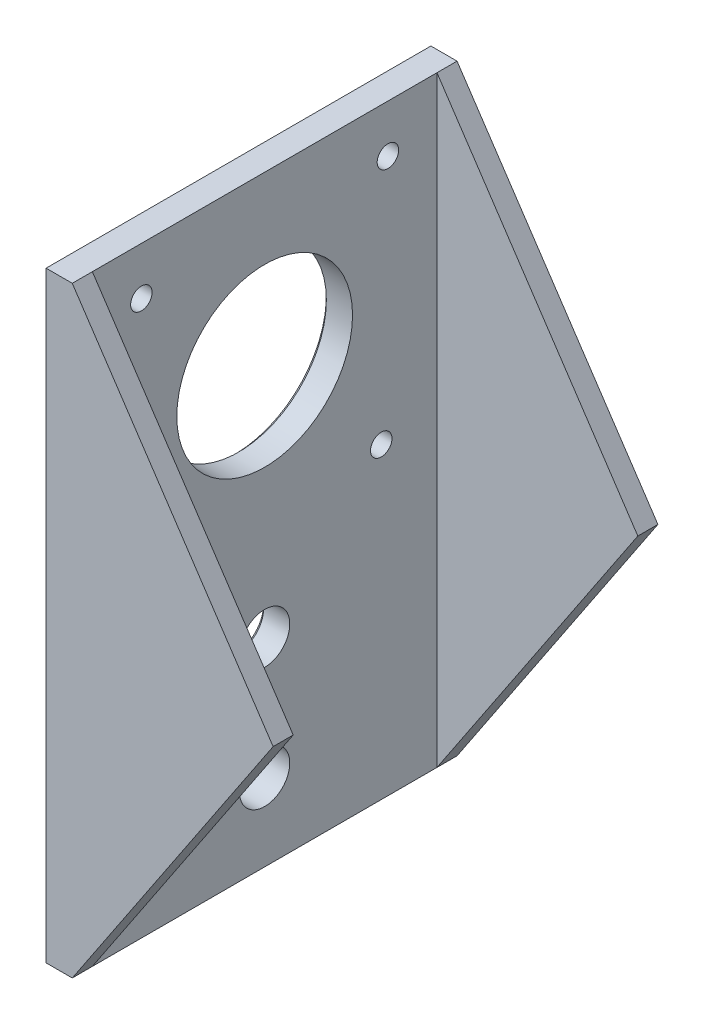
from build123d import *

# Parameters (mm, degrees)
SKETCH1_R           = 11.1125
SKETCH1_R_2         = 1.3589
SKETCH1_R_3         = 3.175
BOSS_EXTRUDE1_DEPTH = 3.81
BOSS_EXTRUDE2_DEPTH = 2.54
CHAMFER1_SIZE       = 0.5


with BuildPart() as part:
    # Sketch1 → Boss-Extrude1 (new body)
    with BuildSketch(Plane(origin=(0, 0, 0), x_dir=(0, 0, -1), z_dir=(1, 0, 0))):
        Polygon((21.79, -21.209), (21.79, -54.874917619), (-21.79, -54.874917619), (-21.79, -21.209), (-21.79, 21.209), (21.79, 21.209), align=None)
        with Locations(Location((0, 0, 0), (0, 0, 180))):
            Circle(SKETCH1_R, mode=Mode.SUBTRACT)
        with Locations(Location((15.588824177, 15.173169893, 0), (0, 0, 180))):
            Circle(SKETCH1_R_2, mode=Mode.SUBTRACT)
        with Locations(Location((-15.588824177, 15.173169893, 0), (0, 0, 180))):
            Circle(SKETCH1_R_2, mode=Mode.SUBTRACT)
        with Locations(Location((-14.746436813, -15.993096172, 0), (0, 0, 180))):
            Circle(SKETCH1_R_2, mode=Mode.SUBTRACT)
        with Locations(Location((14.746436813, -15.993096172, 0), (0, 0, 180))):
            Circle(SKETCH1_R_2, mode=Mode.SUBTRACT)
        with Locations(Location((0, -29.845, 0), (0, 0, 180))):
            Circle(SKETCH1_R_3, mode=Mode.SUBTRACT)
        with Locations(Location((0, -45.085, 0), (0, 0, 180))):
            Circle(SKETCH1_R_3, mode=Mode.SUBTRACT)
    extrude(amount=BOSS_EXTRUDE1_DEPTH)

    # Sketch15 → Boss-Extrude2 (add)
    with BuildSketch(Plane.XY.offset(21.79)):
        Polygon((3.81, 21.209), (29.21, -16.832958809), (3.81, -54.874917619), (0, -54.874917619), (0, 21.209), align=None)
    boss_extrude2 = extrude(amount=BOSS_EXTRUDE2_DEPTH)

    # Mirror1: Boss-Extrude2 across plane
    add(boss_extrude2.mirror(Plane.XY))

    # Chamfer1
    chamfer1_edges = [part.edges().sort_by_distance(p)[0] for p in [
        (0, 0, -11.1125),
        (0, 15.173169893, -16.947724177),
        (0, 15.173169893, 14.229924177),
        (0, -15.993096172, 13.387536813),
        (0, -15.993096172, -16.105336813),
        (0, -29.845, -3.175),
        (0, -45.085, -3.175),
        (0, -16.832958809, 24.33),
        (0, -16.832958809, -24.33),
        (0, -54.874917619, 0),
        (0, 21.209, 0),
    ]]
    chamfer(chamfer1_edges, length=CHAMFER1_SIZE)


solid = part.part
